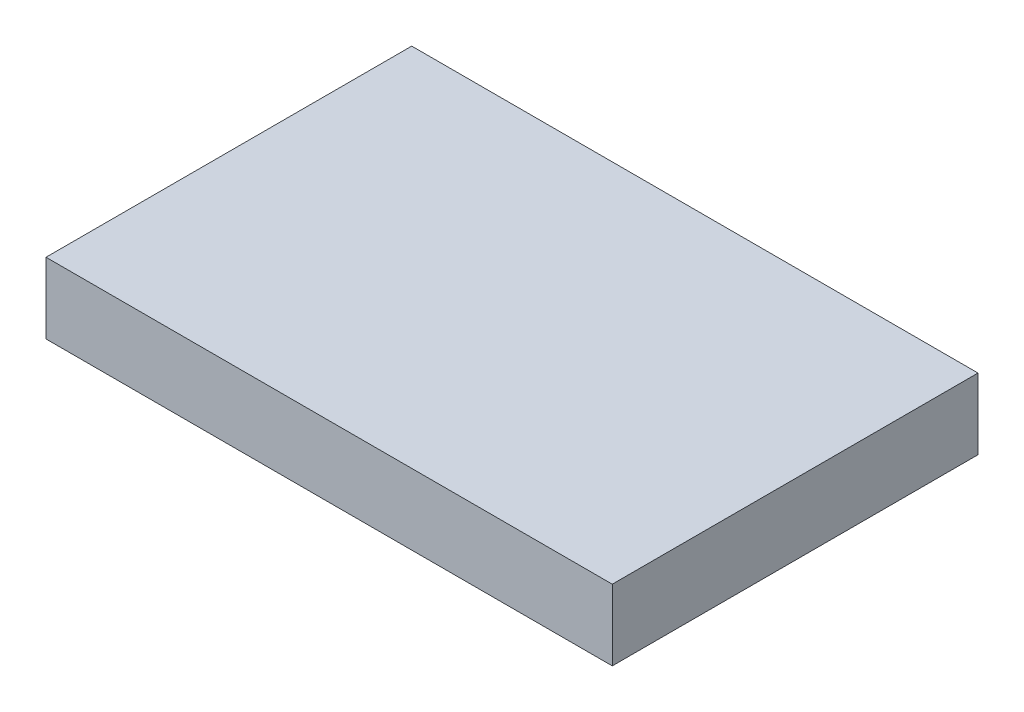
from build123d import *

# Parameters (mm, degrees)
SKETCH1_W           = 48
SKETCH1_H           = 31
BOSS_EXTRUDE1_DEPTH = 6


with BuildPart() as part:
    # Sketch1 → Boss-Extrude1 (new body)
    with BuildSketch(Plane(origin=(0, 0, 0), x_dir=(1, 0, 0), z_dir=(0, 1, 0))):
        Rectangle(SKETCH1_W, SKETCH1_H)
    extrude(amount=BOSS_EXTRUDE1_DEPTH)


solid = part.part
